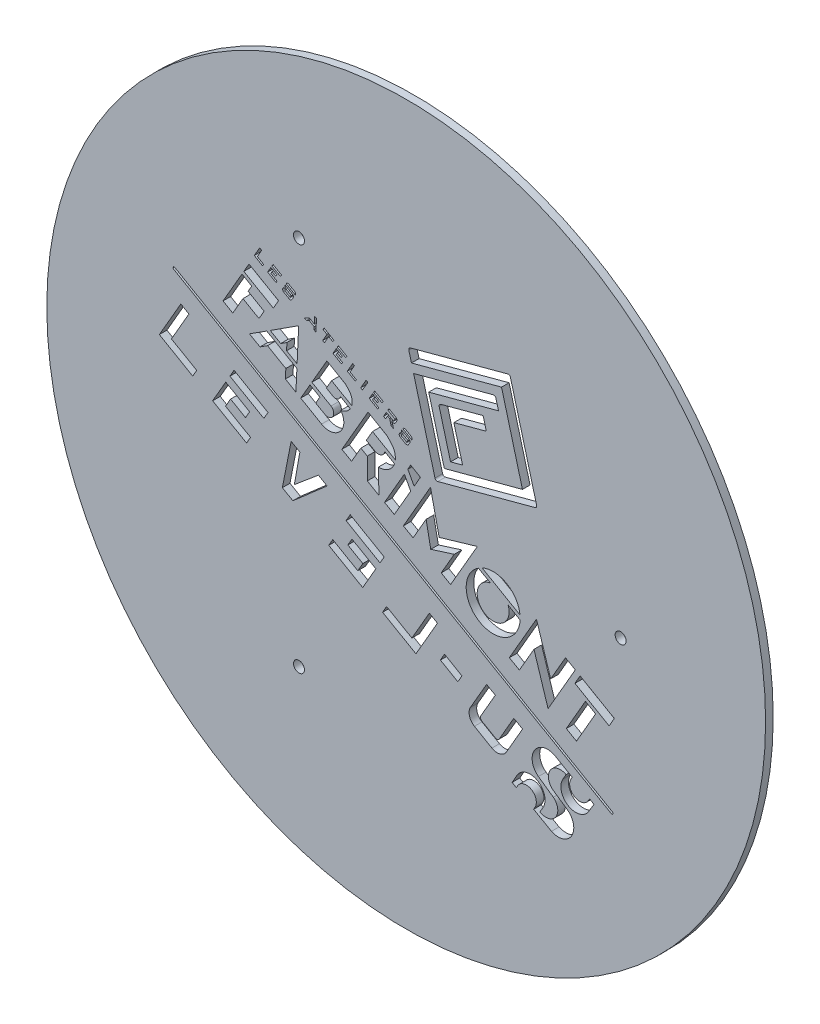
from build123d import *

# Parameters (mm, degrees)
ESQUISSE1_R        = 150
ESQUISSE1_R_2      = 2.29375
BOSS_EXTRU_1_DEPTH = 3.175


with BuildPart() as part:
    # Esquisse1 → Boss.-Extru.1 (new body)
    with BuildSketch(Plane.XY):
        with Locations((69.906558294, 103.303590192)):
            Circle(ESQUISSE1_R)
        with Locations((25.161912431, 25.803590191)):
            Circle(ESQUISSE1_R_2, mode=Mode.SUBTRACT)
        with Locations((25.161912431, 180.803590193)):
            Circle(ESQUISSE1_R_2, mode=Mode.SUBTRACT)
        with Locations((159.395850018, 103.303590192)):
            Circle(ESQUISSE1_R_2, mode=Mode.SUBTRACT)
        Polygon((1.779454635, 147.168247115), (-2.466205085, 139.814548769), (-6.531680483, 142.161752084), (1.373763358, 155.854382474), (5.439238757, 153.507179158), (3.9259103, 150.886017382), (10.612547469, 147.025485613), (8.466091805, 143.307715345), align=None, mode=Mode.SUBTRACT)
        Polygon((13.946333041, 162.998024896), (13.419868914, 162.08616228), (16.030933206, 160.578663608), (15.613228501, 159.855177835), (12.070386222, 161.900638779), (13.445472105, 164.282357393), (15.936632856, 162.844085063), (15.505715805, 162.097714837), align=None, mode=Mode.SUBTRACT)
        Polygon((13.878166833, 165.031806646), (17.421009112, 162.986345703), (17.856129188, 163.739995781), (14.313286908, 165.785456725), align=None, mode=Mode.SUBTRACT)
        with BuildLine():
            Line((18.768255076, 158.033622393), (21.033816057, 156.725600151))
            ThreePointArc((21.033816057, 156.725600151), (21.684313684, 156.639960514), (22.204841335, 157.039375429))
            Line((22.204841335, 157.039375429), (22.722677219, 157.93629349))
            ThreePointArc((22.722677219, 157.93629349), (22.808316856, 158.586791115), (22.408901943, 159.107318765))
            Line((22.408901943, 159.107318765), (19.400940686, 160.843966007))
            Line((19.400940686, 160.843966007), (19.398648633, 160.839996055))
            ThreePointArc((19.398648633, 160.839996055), (19.313008996, 160.189498429), (19.712423911, 159.668970777))
            Line((19.712423911, 159.668970777), (21.977984891, 158.360948536))
            Line((21.977984891, 158.360948536), (21.451520765, 157.44908592))
            Line((21.451520765, 157.44908592), (19.188543102, 158.755616683))
            Line((19.188543102, 158.755616683), (19.458381339, 159.22299022))
            Line((19.458381339, 159.22299022), (18.713397743, 159.653106699))
            Line((18.713397743, 159.653106699), (18.454479801, 159.204647668))
            ThreePointArc((18.454479801, 159.204647668), (18.368840163, 158.554150043), (18.768255076, 158.033622393))
        make_face(mode=Mode.SUBTRACT)
        Polygon((39.73135276, 151.110329562), (39.296232685, 150.356679484), (37.586358611, 151.343875741), (35.778578, 148.212707874), (35.045774825, 148.635791984), (36.853555436, 151.766959851), (35.178576754, 152.734009245), (35.613696829, 153.487659322), align=None, mode=Mode.SUBTRACT)
        Polygon((41.582621241, 150.041499205), (41.147501166, 149.287849128), (44.690343437, 147.242388189), (45.125463512, 147.996038266), align=None, mode=Mode.SUBTRACT)
        Polygon((43.205967189, 147.100127547), (42.775050137, 146.35375732), (41.215667369, 147.254067381), (40.690464453, 146.344389247), (43.301528743, 144.836890576), (42.882562827, 144.111220323), (39.339720555, 146.156681262), (40.714806438, 148.538399877), align=None, mode=Mode.SUBTRACT)
        Polygon((45.326311442, 142.700321401), (48.687014182, 140.760018769), (49.105980099, 141.485689024), (46.480426608, 143.001553039), (48.304361377, 146.160700729), (47.569212128, 146.585139346), align=None, mode=Mode.SUBTRACT)
        Polygon((50.914991428, 139.473695507), (51.657650506, 139.044921089), (53.900551192, 142.929739034), (53.157892114, 143.358513452), align=None, mode=Mode.SUBTRACT)
        Polygon((56.721559032, 141.301029396), (60.264401304, 139.255568457), (59.829281229, 138.50191838), (56.286438957, 140.547379319), align=None, mode=Mode.SUBTRACT)
        with BuildLine():
            Line((69.669745102, 133.825390685), (71.935306081, 132.517368444))
            ThreePointArc((71.935306081, 132.517368444), (72.334720995, 131.996840793), (72.249081358, 131.346343168))
            Line((72.249081358, 131.346343168), (72.242586283, 131.335093366))
            Line((72.242586283, 131.335093366), (68.492224749, 133.500365607))
            Line((68.492224749, 133.500365607), (68.498719824, 133.511615407))
            ThreePointArc((68.498719824, 133.511615407), (69.019247475, 133.911030322), (69.669745102, 133.825390685))
        make_face(mode=Mode.SUBTRACT)
        with BuildLine():
            Line((68.059530022, 132.750916356), (71.067491278, 131.014269115))
            ThreePointArc((71.067491278, 131.014269115), (71.466906193, 130.493741464), (71.381266556, 129.843243837))
            Line((71.381266556, 129.843243837), (70.863430672, 128.946325776))
            ThreePointArc((70.863430672, 128.946325776), (70.342903021, 128.546910861), (69.692405394, 128.632550499))
            Line((69.692405394, 128.632550499), (67.426844416, 129.94057274))
            ThreePointArc((67.426844416, 129.94057274), (67.027429501, 130.461100391), (67.113069138, 131.111598018))
            Line((67.113069138, 131.111598018), (67.371987079, 131.560057047))
            Line((67.371987079, 131.560057047), (68.116970674, 131.129940568))
            Line((68.116970674, 131.129940568), (67.847132438, 130.662567032))
            Line((67.847132438, 130.662567032), (70.110110099, 129.35603627))
            Line((70.110110099, 129.35603627), (70.636574226, 130.267898887))
            Line((70.636574226, 130.267898887), (68.371013246, 131.575921129))
            ThreePointArc((68.371013246, 131.575921129), (67.971598332, 132.096448779), (68.057237969, 132.746946404))
            Line((68.057237969, 132.746946404), (68.059530022, 132.750916356))
        make_face(mode=Mode.SUBTRACT)
        with BuildLine():
            Line((88.416489438, 131.467179305), (83.682429495, 149.07097264))
            ThreePointArc((83.682429495, 149.07097264), (83.776928263, 149.793833893), (84.354889077, 150.238153267))
            Line((84.354889077, 150.238153267), (102.008599012, 154.985636914))
            Line((102.008599012, 154.985636914), (103.347816191, 150.005703655))
            Line((103.347816191, 150.005703655), (89.799439877, 146.362237475))
            Line((89.799439877, 146.362237475), (93.430213919, 132.815483721))
            Line((93.430213919, 132.815483721), (88.416489438, 131.467179305))
        make_face(mode=Mode.SUBTRACT)
        Polygon((25.031261382, 148.97151195), (24.369631894, 134.872540071), (19.97973911, 137.407045851), (20.123525851, 140.471064661), (17.543845188, 138.813409863), (13.160954005, 141.343873268), align=None, mode=Mode.SUBTRACT)
        Polygon((4.511560511, 135.785933924), (11.707327044, 140.409799629), (24.288609354, 133.145992901), (23.878751843, 124.412147693), (19.488859061, 126.946653472), (19.672378727, 130.85735973), (12.029486545, 135.269985589), (8.894451695, 133.25547052), align=None, mode=Mode.SUBTRACT)
        with BuildLine():
            Line((38.771771938, 136.010144982), (36.59935175, 132.247402841))
            Line((36.59935175, 132.247402841), (39.541282219, 130.548878493))
            ThreePointArc((39.541282219, 130.548878493), (41.365895717, 130.667248246), (42.453505808, 132.137054392))
            Line((42.453505808, 132.137054392), (46.561641632, 129.765221068))
            ThreePointArc((46.561641632, 129.765221068), (44.887759053, 128.037979425), (42.62963861, 127.209644561))
            ThreePointArc((42.62963861, 127.209644561), (42.312088622, 119.407890998), (34.593865599, 118.225846155))
            Line((34.593865599, 118.225846155), (25.884503173, 123.254198896))
            Line((25.884503173, 123.254198896), (29.768833463, 129.982056312))
            Line((29.768833463, 129.982056312), (33.881273973, 127.607737677))
            Line((33.881273973, 127.607737677), (32.150937058, 124.610706226))
            Line((32.150937058, 124.610706226), (35.91644734, 122.436687851))
            ThreePointArc((35.91644734, 122.436687851), (39.300452047, 123.300099578), (38.518390462, 126.703825088))
            Line((38.518390462, 126.703825088), (30.536707507, 131.31205189))
            Line((30.536707507, 131.31205189), (36.807148785, 142.172774769))
            Line((36.807148785, 142.172774769), (44.595404393, 137.676223297))
            Line((44.595404393, 137.676223297), (45.945736948, 136.186086511))
            ThreePointArc((45.945736948, 136.186086511), (47.192015808, 133.831336772), (47.159801989, 131.167313575))
            Line((47.159801989, 131.167313575), (38.771771938, 136.010144982))
        make_face(mode=Mode.SUBTRACT)
        with BuildLine():
            Line((55.847872463, 126.151182088), (53.264651754, 121.676912572))
            Line((53.264651754, 121.676912572), (56.862968204, 119.599423601))
            ThreePointArc((56.862968204, 119.599423601), (59.389101802, 119.471969858), (60.969353606, 121.446912805))
            Line((60.969353606, 121.446912805), (65.022824871, 119.106640079))
            ThreePointArc((65.022824871, 119.106640079), (62.436261775, 115.723660893), (58.339240055, 114.562080139))
            Line((58.339240055, 114.562080139), (58.511202324, 104.417093081))
            Line((58.511202324, 104.417093081), (53.677821315, 107.207646907))
            Line((53.677821315, 107.207646907), (53.657401595, 116.189912793))
            Line((53.657401595, 116.189912793), (50.986898604, 117.731728414))
            Line((50.986898604, 117.731728414), (47.102568313, 111.003870996))
            Line((47.102568313, 111.003870996), (43.069303599, 113.332477465))
            Line((43.069303599, 113.332477465), (53.991947655, 132.251051922))
            Line((53.991947655, 132.251051922), (61.806043107, 127.739581809))
            Line((61.806043107, 127.739581809), (63.558275948, 125.931057859))
            ThreePointArc((63.558275948, 125.931057859), (65.028392913, 123.489703829), (65.360153267, 120.659264205))
            Line((65.360153267, 120.659264205), (55.847872463, 126.151182088))
        make_face(mode=Mode.SUBTRACT)
        Polygon((70.593862197, 119.921270784), (73.221885707, 115.055365642), (75.860351776, 119.625322928), (71.782335411, 121.979766774), align=None, mode=Mode.SUBTRACT)
        Polygon((78.220497409, 105.615401515), (72.774290866, 96.182295075), (68.735126651, 98.514307622), (80.047608785, 118.108101438), (83.666250103, 101.798217398), (99.608169883, 106.49113849), (88.435839988, 87.140095474), (84.516901034, 89.402695934), (89.963107576, 98.835802374), (80.15536344, 95.738722723), align=None, mode=Mode.SUBTRACT)
        with BuildLine():
            Line((112.46713248, 91.714595907), (117.446186251, 88.839937874))
            ThreePointArc((117.446186251, 88.839937874), (100.565147352, 79.706423695), (100.03448321, 98.892589313))
            Line((100.03448321, 98.892589313), (105.013536983, 96.017931277))
            ThreePointArc((105.013536983, 96.017931277), (102.867189529, 83.693677711), (112.46713248, 91.714595907))
        make_face(mode=Mode.SUBTRACT)
        Polygon((140.32515309, 77.378201385), (154.600666459, 69.136229899), (156.778006376, 72.90749326), (142.502493007, 81.149464747), align=None, mode=Mode.SUBTRACT)
        Polygon((136.734895444, 59.254622804), (144.72353536, 73.091353022), (148.966535165, 70.641655942), (140.977895249, 56.804925724), align=None, mode=Mode.SUBTRACT)
        Polygon((-27.017173202, 144.403695908), (-27.516450195, 143.53892279), (155.853375602, 37.670304504), (156.352652595, 38.535077623), align=None, mode=Mode.SUBTRACT)
        Polygon((-3.662511142, 116.410735748), (10.50885797, 108.228891977), (12.238711579, 111.225086317), (-1.932657533, 119.406930089), align=None, mode=Mode.SUBTRACT)
        Polygon((-10.893633586, 103.88606428), (3.277735526, 95.704220508), (4.948554346, 98.598163595), (-5.495702816, 104.62815828), (-3.38984631, 108.275608742), (2.847684743, 104.67436851), (4.57135295, 107.659849419), (-5.393290052, 113.412938739), align=None, mode=Mode.SUBTRACT)
        Polygon((85.902916112, 60.703049534), (84.179247907, 57.717568626), (91.466467389, 53.510290496), (93.190135595, 56.495771404), align=None, mode=Mode.SUBTRACT)
        Polygon((61.720648531, 65.832430308), (72.280599395, 59.735639835), (79.576338473, 72.372230597), (82.94788904, 70.42566497), (73.976286295, 54.88639319), (60.044784865, 62.929749291), align=None, mode=Mode.SUBTRACT)
        Polygon((60.723504892, 83.25691914), (46.552135782, 91.438762911), (44.811655481, 88.4241626), (58.983024591, 80.24231883), align=None, mode=Mode.SUBTRACT)
        Polygon((39.251351857, 78.793434219), (37.580533037, 75.899491132), (51.751902147, 67.717647362), (57.25224568, 77.244521821), (47.287602678, 82.99761114), (45.563934472, 80.012130231), (51.801465524, 76.410889998), (49.695609018, 72.763439535), align=None, mode=Mode.SUBTRACT)
        with BuildLine():
            Line((111.749906207, 38.290709542), (118.46424579, 49.920286839))
            Line((118.46424579, 49.920286839), (114.826324089, 52.020641912))
            Line((114.826324089, 52.020641912), (108.780727834, 41.549362036))
            ThreePointArc((108.780727834, 41.549362036), (108.009575759, 40.957636237), (107.045875571, 41.084509773))
            Line((107.045875571, 41.084509773), (101.519977365, 44.27488859))
            ThreePointArc((101.519977365, 44.27488859), (100.928251565, 45.046040666), (101.055125102, 46.009740853))
            Line((101.055125102, 46.009740853), (107.100721358, 56.48102073))
            Line((107.100721358, 56.48102073), (103.462799657, 58.581375803))
            Line((103.462799657, 58.581375803), (96.748460073, 46.951798504))
            ThreePointArc((96.748460073, 46.951798504), (96.304402695, 43.57884785), (98.375442991, 40.879815586))
            Line((98.375442991, 40.879815586), (105.677923286, 36.663726622))
            ThreePointArc((105.677923286, 36.663726622), (109.050873942, 36.219669244), (111.749906207, 38.290709542))
        make_face(mode=Mode.SUBTRACT)
        with BuildLine():
            Line((114.117113471, 28.467740702), (116.157912999, 32.075406891))
            ThreePointArc((116.157912999, 32.075406891), (124.720988622, 34.36987609), (127.015457819, 25.806800467))
            Line((127.015457819, 25.806800467), (125.709445705, 23.602748718))
            ThreePointArc((125.709445705, 23.602748718), (132.298315814, 25.044826738), (131.300580903, 31.715458146))
            Line((131.300580903, 31.715458146), (125.080352779, 36.07898436))
            ThreePointArc((125.080352779, 36.07898436), (123.328845853, 44.565197372), (131.553875367, 47.291454386))
            Line((131.553875367, 47.291454386), (139.213236347, 42.869320262))
            Line((139.213236347, 42.869320262), (138.687686541, 41.959041296))
            ThreePointArc((138.687686541, 41.959041296), (140.216749561, 36.252500413), (145.923290444, 37.781563436))
            Line((145.923290444, 37.781563436), (146.44884025, 38.691842402))
            Line((146.44884025, 38.691842402), (148.278093011, 37.635722829))
            Line((148.278093011, 37.635722829), (146.113991774, 34.011700869))
            ThreePointArc((146.113991774, 34.011700869), (137.590939926, 31.727956005), (135.307195069, 40.251007855))
            Line((135.307195069, 40.251007855), (136.640142835, 42.535271521))
            ThreePointArc((136.640142835, 42.535271521), (130.1032457, 40.974342664), (131.078864526, 34.324854642))
            Line((131.078864526, 34.324854642), (136.820304323, 30.369684706))
            ThreePointArc((136.820304323, 30.369684706), (139.034847907, 21.718428338), (130.531352048, 18.990975643))
            Line((130.531352048, 18.990975643), (123.114615242, 23.273030634))
            Line((123.114615242, 23.273030634), (123.653632211, 24.206635409))
            ThreePointArc((123.653632211, 24.206635409), (122.12041019, 29.928697891), (116.398347709, 28.395475868))
            Line((116.398347709, 28.395475868), (115.859330741, 27.461871093))
            Line((115.859330741, 27.461871093), (114.117113471, 28.467740702))
        make_face(mode=Mode.SUBTRACT)
        Polygon((18.226831341, 87.048814718), (22.609842859, 84.518281839), (36.890662913, 96.992275577), (33.252741211, 99.092630653), (23.221455627, 90.63869199), (25.527138478, 103.553009469), (21.889216777, 105.653364543), align=None, mode=Mode.SUBTRACT)
        Polygon((-17.510652637, 111.576643367), (-28.070603499, 117.673433839), (-20.774864421, 130.310024601), (-24.146414987, 132.256590229), (-33.118017732, 116.71731845), (-19.186516304, 108.67396235), align=None, mode=Mode.SUBTRACT)
        Polygon((112.964550026, 72.97843813), (117.13175432, 70.572501609), (123.233371611, 81.140812766), (129.115783971, 62.627565439), (140.482678894, 82.31560497), (136.403368871, 84.67079571), (130.212964587, 73.94870097), (124.277032161, 92.572231947), align=None, mode=Mode.SUBTRACT)
        with BuildLine():
            Line((101.58930535, 99.742353507), (117.40469256, 90.611335444))
            ThreePointArc((117.40469256, 90.611335444), (111.830655362, 99.21885594), (101.58930535, 99.742353507))
        make_face(mode=Mode.SUBTRACT)
        Polygon((60.85969135, 103.061192313), (64.937707718, 100.706748465), (71.786354371, 112.568952431), (69.143869341, 117.409809491), align=None, mode=Mode.SUBTRACT)
        with BuildLine():
            Line((106.190625293, 164.604091644), (72.991146884, 155.706033364))
            Line((72.991146884, 155.706033364), (81.923047514, 122.380286))
            ThreePointArc((81.923047514, 122.380286), (82.366878999, 121.801950439), (83.089660249, 121.706841696))
            Line((83.089660249, 121.706841696), (123.663715435, 132.581419398))
            ThreePointArc((123.663715435, 132.581419398), (124.242050996, 133.025250884), (124.337159739, 133.748032134))
            Line((124.337159739, 133.748032134), (113.417898473, 174.488805836))
            ThreePointArc((113.417898473, 174.488805836), (112.974066987, 175.067141397), (112.251285738, 175.16225014))
            Line((112.251285738, 175.16225014), (71.677230551, 164.287672438))
            ThreePointArc((71.677230551, 164.287672438), (71.098894992, 163.843840952), (71.003786249, 163.121059703))
            Line((71.003786249, 163.121059703), (72.095231536, 159.048776393))
            Line((72.095231536, 159.048776393), (109.688577901, 169.12447043))
            Line((109.688577901, 169.12447043), (118.427536451, 136.518607819))
            Line((118.427536451, 136.518607819), (85.817486288, 127.778526929))
            Line((85.817486288, 127.778526929), (79.294121562, 152.117804085))
            Line((79.294121562, 152.117804085), (108.430332284, 159.926833427))
            Line((108.430332284, 159.926833427), (107.357238029, 163.93064734))
            ThreePointArc((107.357238029, 163.93064734), (106.913406543, 164.508982901), (106.190625293, 164.604091644))
        make_face(mode=Mode.SUBTRACT)
        with BuildLine():
            Line((65.952813082, 134.981495353), (65.409632857, 134.040679604))
            ThreePointArc((65.409632857, 134.040679604), (64.889105205, 133.641264689), (64.238607579, 133.726904326))
            Line((64.238607579, 133.726904326), (63.92768916, 133.906413159))
            Line((63.92768916, 133.906413159), (64.608945242, 131.567487588))
            Line((64.608945242, 131.567487588), (63.586479563, 132.157808423))
            Line((63.586479563, 132.157808423), (63.014427712, 134.4197738))
            Line((63.014427712, 134.4197738), (62.148461882, 134.919739406))
            Line((62.148461882, 134.919739406), (61.312015104, 133.470971089))
            Line((61.312015104, 133.470971089), (60.45074876, 133.968223445))
            Line((60.45074876, 133.968223445), (61.618498043, 135.990824534))
            Line((61.618498043, 135.990824534), (64.587295676, 134.276788421))
            Line((64.587295676, 134.276788421), (65.227327006, 135.385355202))
            Line((65.227327006, 135.385355202), (62.258529372, 137.099391315))
            Line((62.258529372, 137.099391315), (62.693649447, 137.853041393))
            Line((62.693649447, 137.853041393), (65.639037805, 136.152520631))
            ThreePointArc((65.639037805, 136.152520631), (66.03845272, 135.63199298), (65.952813082, 134.981495353))
        make_face(mode=Mode.SUBTRACT)
        Polygon((54.478658347, 137.416211451), (58.021500618, 135.370750512), (58.440466534, 136.096420765), (55.829402243, 137.603919436), (56.354605158, 138.513597568), (57.913987927, 137.613287507), (58.34490498, 138.359657736), (55.85374423, 139.797930066), align=None, mode=Mode.SUBTRACT)
        Polygon((31.488552349, 151.886108044), (31.43038181, 150.723140116), (32.284101137, 150.230245033), (32.423702048, 155.329403666), (31.682196268, 155.757512227), (31.536385326, 152.842403473), (29.475303309, 154.03236973), (27.51432321, 152.984077603), (28.310621192, 152.524334749), (29.353868686, 153.118568231), align=None, mode=Mode.SUBTRACT)
        with BuildLine():
            Line((21.011155763, 161.918440335), (23.276716738, 160.610418096))
            ThreePointArc((23.276716738, 160.610418096), (23.677861849, 160.083608556), (23.583996943, 159.428143019))
            Line((23.583996943, 159.428143019), (19.833635412, 161.593415258))
            Line((19.833635412, 161.593415258), (19.840130485, 161.604665058))
            ThreePointArc((19.840130485, 161.604665058), (20.360658136, 162.004079973), (21.011155763, 161.918440335))
        make_face(mode=Mode.SUBTRACT)
        Polygon((9.600078514, 168.506628858), (8.757190873, 168.993270265), (6.514290186, 165.10845232), (9.997165542, 163.097613296), (10.416131459, 163.823283551), (7.776143744, 165.347481168), align=None, mode=Mode.SUBTRACT)
        Polygon((16.637926439, 153.817406137), (4.3077675, 160.93622672), (2.130427582, 157.164963358), (14.460586522, 150.046142775), align=None, mode=Mode.SUBTRACT)
    extrude(amount=BOSS_EXTRU_1_DEPTH)


solid = part.part
